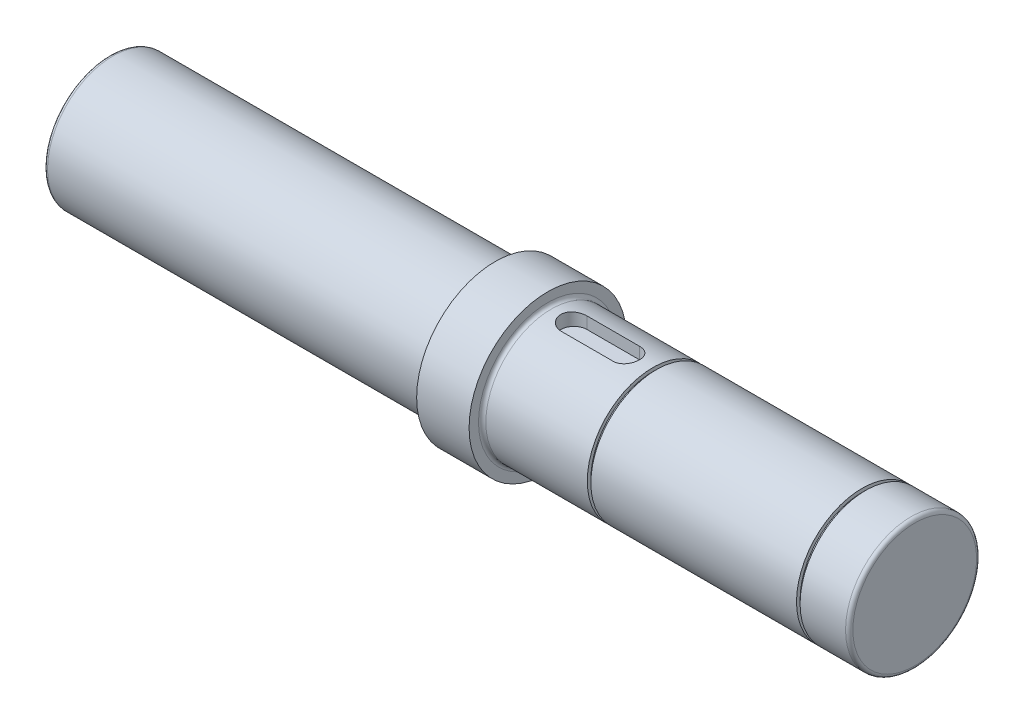
from build123d import *

# Parameters (mm, degrees)
CUT_EXTRUDE1_START = 25.4
CUT_EXTRUDE1_DEPTH = 185.822406037


with BuildPart() as part:
    # Sketch1 → Revolve1 (revolve)
    with BuildSketch(Plane(origin=(0, 0, 0), x_dir=(1, 0, 0), z_dir=(0, 1, 0))):
        with BuildLine():
            Line((-186.944, 0), (0, 0))
            Line((0, 0), (203.2, 0))
            Line((203.2, 0), (203.2, 29.972))
            ThreePointArc((203.2, 29.972), (202.679235857, 31.229235857), (201.422, 31.75))
            Line((201.422, 31.75), (179.4002, 31.75))
            Line((179.4002, 31.75), (179.4002, 30.0228))
            Line((179.4002, 30.0228), (177.673, 30.0228))
            Line((177.673, 30.0228), (177.673, 31.75))
            Line((177.673, 31.75), (78.0542, 31.75))
            Line((78.0542, 31.75), (78.0542, 30.0228))
            Line((78.0542, 30.0228), (76.327, 30.0228))
            Line((76.327, 30.0228), (76.327, 31.75))
            Line((76.327, 31.75), (27.178, 31.75))
            ThreePointArc((27.178, 31.75), (25.920764143, 32.270764143), (25.4, 33.528))
            Line((25.4, 33.528), (25.4, 38.1))
            Line((25.4, 38.1), (0, 38.1))
            Line((0, 38.1), (0, 33.528))
            ThreePointArc((0, 33.528), (-0.520764143, 32.270764143), (-1.778, 31.75))
            Line((-1.778, 31.75), (-185.166, 31.75))
            ThreePointArc((-185.166, 31.75), (-186.423235857, 31.229235857), (-186.944, 29.972))
            Line((-186.944, 29.972), (-186.944, 0))
        make_face()
    revolve(axis=Axis((0, 0, 0), (1, 0, 0)))

    # Sketch1<4> → Cut-Extrude1 (cut, through all)
    with BuildSketch(Plane(origin=(0, 0, 0), x_dir=(1, 0, 0), z_dir=(0, 1, 0)).offset(CUT_EXTRUDE1_START)):
        with BuildLine():
            Line((38.1, 6.35), (63.5, 6.35))
            ThreePointArc((63.5, 6.35), (69.85, 0), (63.5, -6.35))
            Line((63.5, -6.35), (38.1, -6.35))
            ThreePointArc((38.1, -6.35), (31.75, 0), (38.1, 6.35))
        make_face()
    extrude(amount=CUT_EXTRUDE1_DEPTH, mode=Mode.SUBTRACT)


solid = part.part
